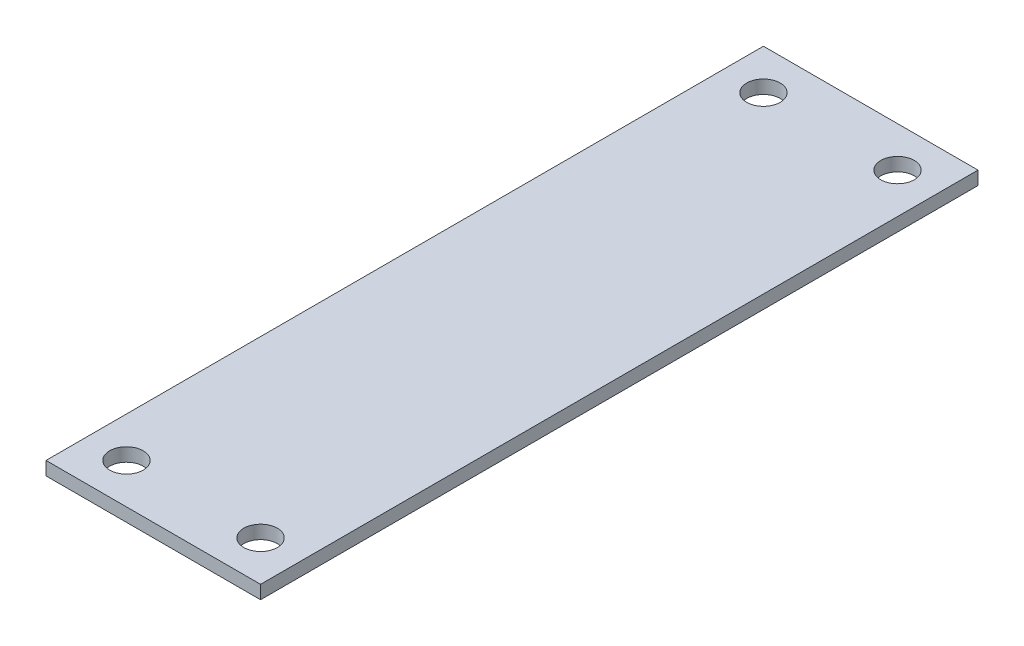
from build123d import *

# Parameters (mm, degrees)
SKETCH_1_W      = 32
SKETCH_1_H      = 107
SKETCH_1_R      = 2.5
EXTRUDE_1_DEPTH = 2


with BuildPart() as part:
    # 草图1 → 凸台-拉伸1 (new body)
    with BuildSketch(Plane(origin=(0, 0, 0), x_dir=(1, 0, 0), z_dir=(0, 1, 0))):
        with Locations((-0.158095061, 39.2664238)):
            Rectangle(SKETCH_1_W, SKETCH_1_H)
        with Locations(Location((-10.158095061, 86.7664238, 0), (0, 0, 270))):
            Circle(SKETCH_1_R, mode=Mode.SUBTRACT)
        with Locations(Location((9.841904939, 86.7664238, 0), (0, 0, 270))):
            Circle(SKETCH_1_R, mode=Mode.SUBTRACT)
        with Locations(Location((-10.158095061, -8.2335762, 0), (0, 0, 270))):
            Circle(SKETCH_1_R, mode=Mode.SUBTRACT)
        with Locations(Location((9.841904939, -8.2335762, 0), (0, 0, 270))):
            Circle(SKETCH_1_R, mode=Mode.SUBTRACT)
    extrude(amount=EXTRUDE_1_DEPTH)


solid = part.part
